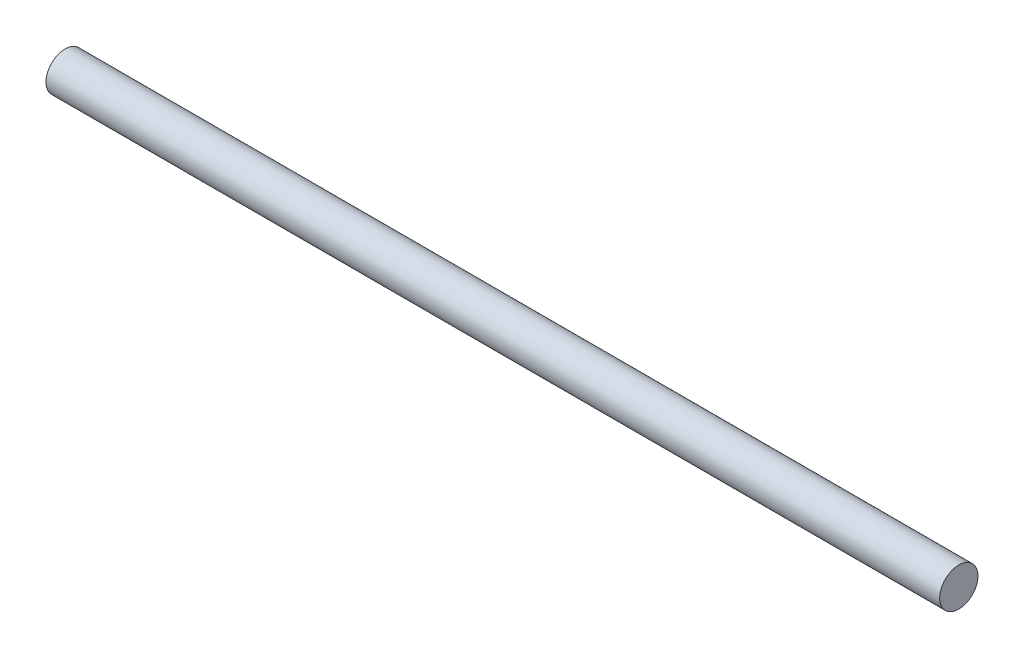
from build123d import *

# Parameters (mm, degrees)
SKETCH1_R           = 1.5
BOSS_EXTRUDE1_DEPTH = 35


with BuildPart() as part:
    # Sketch1 → Boss-Extrude1 (new, symmetric)
    with BuildSketch(Plane(origin=(0, 0, 0), x_dir=(0, 0, -1), z_dir=(1, 0, 0))):
        Circle(SKETCH1_R)
    extrude(amount=BOSS_EXTRUDE1_DEPTH, both=True)


solid = part.part
